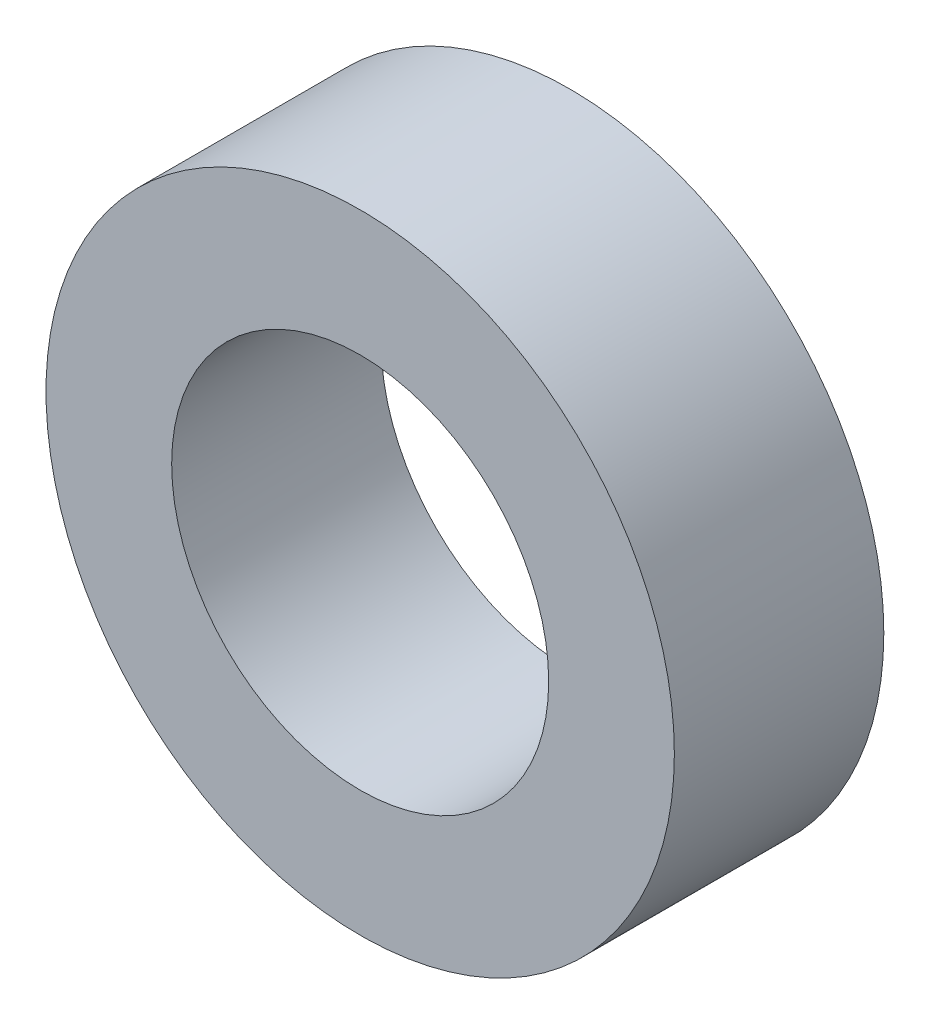
from build123d import *

# Parameters (mm, degrees)
SKETCH1_R           = 7.5
SKETCH1_R_2         = 4.5
BOSS_EXTRUDE1_DEPTH = 5


with BuildPart() as part:
    # Sketch1 → Boss-Extrude1 (new body)
    with BuildSketch(Plane.XY):
        Circle(SKETCH1_R)
        Circle(SKETCH1_R_2, mode=Mode.SUBTRACT)
    extrude(amount=BOSS_EXTRUDE1_DEPTH)


solid = part.part
